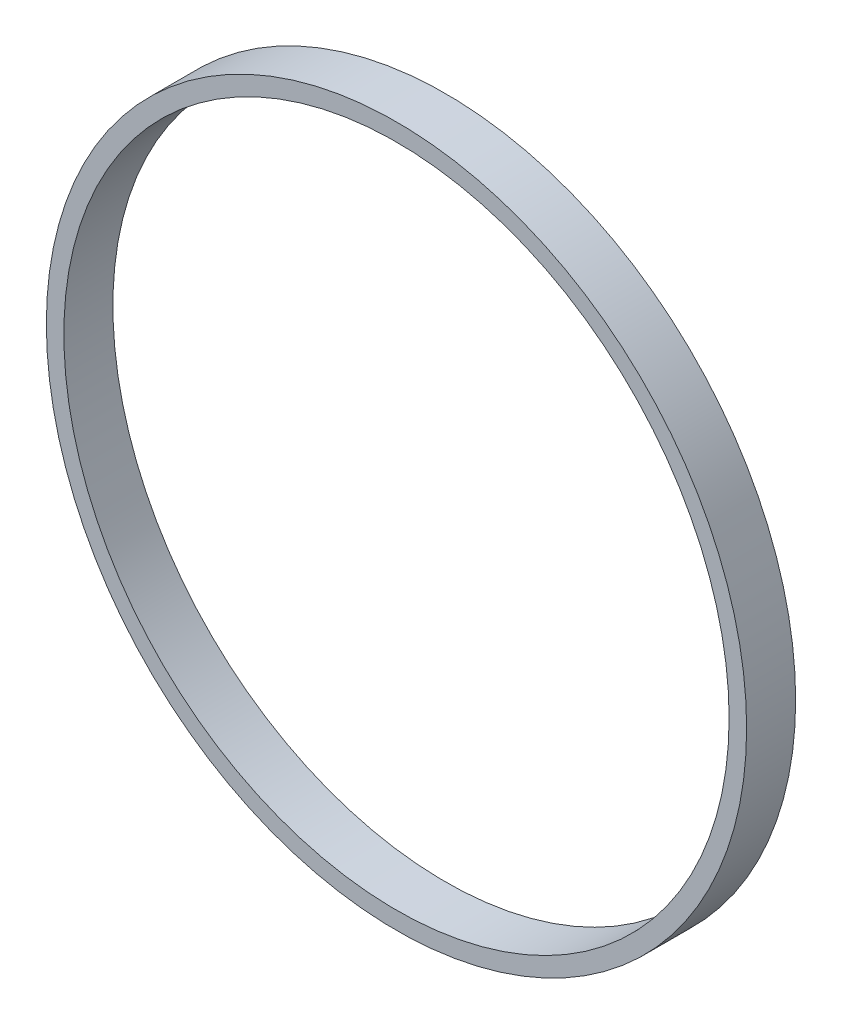
from build123d import *

# Parameters (mm, degrees)
SKETCH1_R           = 50
BOSS_EXTRUDE1_DEPTH = 7
SKETCH2_R           = 47.5
CUT_EXTRUDE1_DEPTH  = 7


with BuildPart() as part:
    # Sketch1 → Boss-Extrude1 (new body)
    with BuildSketch(Plane.XY):
        Circle(SKETCH1_R)
    extrude(amount=BOSS_EXTRUDE1_DEPTH)

    # Sketch2 → Cut-Extrude1 (cut)
    with BuildSketch(Plane.XY.offset(7)):
        Circle(SKETCH2_R)
    extrude(amount=-CUT_EXTRUDE1_DEPTH, mode=Mode.SUBTRACT)


solid = part.part
